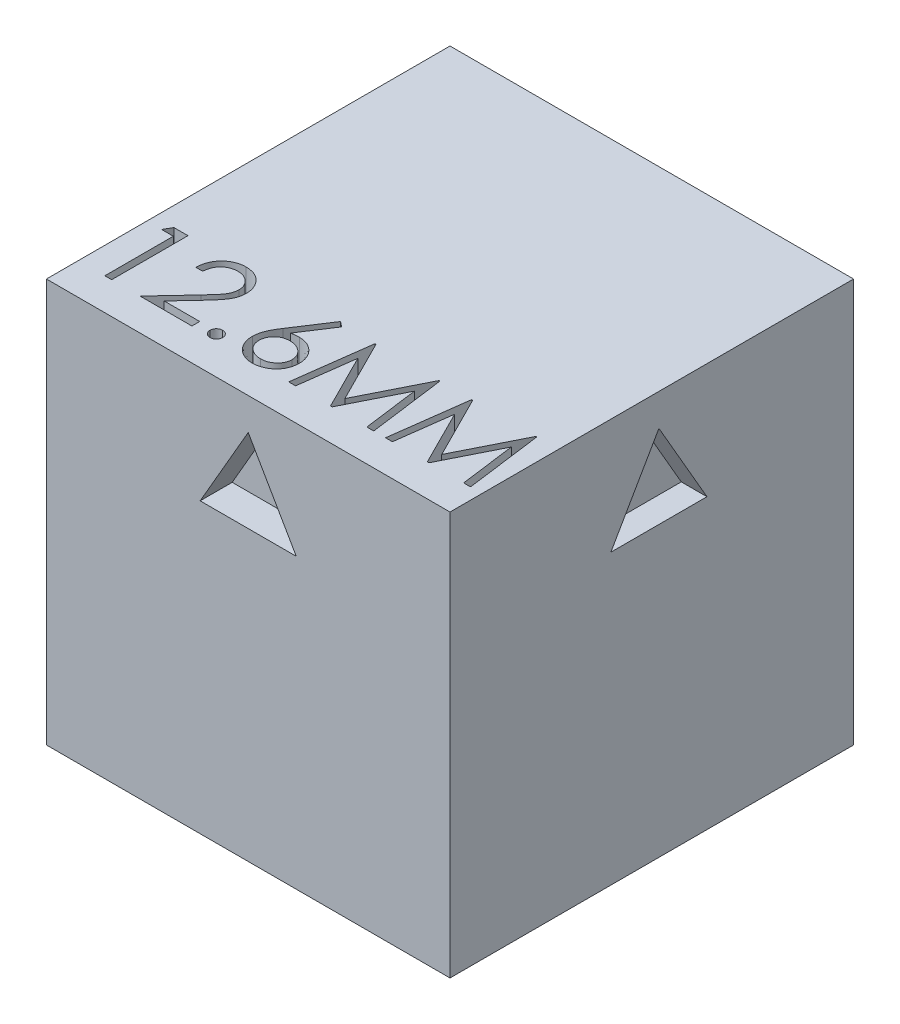
from build123d import *

# Parameters (mm, degrees)
CROQUIS1_W              = 12.6
CROQUIS1_H              = 12.6
SALIENTE_EXTRUIR1_DEPTH = 12.6
CORTAR_EXTRUIR1_DEPTH   = 1
CORTAR_EXTRUIR2_DEPTH   = 1
MATRIZC1_COUNT          = 4


with BuildPart() as part:
    # Croquis1 → Saliente-Extruir1 (new body)
    with BuildSketch(Plane.XY):
        Rectangle(CROQUIS1_W, CROQUIS1_H)
    extrude(amount=SALIENTE_EXTRUIR1_DEPTH)

    # Croquis2 → Cortar-Extruir1 (cut)
    # profile 1 of 6: a face of its own
    with BuildSketch(Plane(origin=(0, 6.3, 0), x_dir=(1, 0, 0), z_dir=(0, 1, 0))):
        Polygon((-5.702302434, -9.21875), (-5.262019231, -9.21875), (-5.262019231, -11.6), (-5.475721154, -11.6), (-5.475721154, -9.462980769), (-5.842067308, -9.462980769), align=None)
    # profile 2 of 6: a face of its own
    with BuildSketch(Plane(origin=(0, 6.3, 0), x_dir=(1, 0, 0), z_dir=(0, 1, 0))):
        with BuildLine():
            Line((-4.071394231, -9.951442308), (-4.285096154, -9.951442308))
            add(Edge.make_bspline(
                [(-4.285096154, -9.951442308), (-4.283703359, -9.923091222), (-4.280967946, -9.867410443), (-4.268157985, -9.786227571), (-4.249828567, -9.708629574), (-4.223912774, -9.635239507), (-4.19172761, -9.565408462), (-4.153130931, -9.499413808), (-4.107415114, -9.437507303), (-4.055567319, -9.38026284), (-3.999255084, -9.327747725), (-3.93849515, -9.282398354), (-3.874647015, -9.244082224), (-3.807904389, -9.212050165), (-3.737514255, -9.188006449), (-3.664115382, -9.170166369), (-3.587385291, -9.159432819), (-3.535106633, -9.158279079), (-3.50851863, -9.157692308)],
                knots=[0, 0, 0, 0, 1.10065271, 2.161652631, 3.183658789, 4.190468796, 5.17591951, 6.163126047, 7.15150782, 8.156236427, 9.156009102, 10.134482811, 11.092018607, 12.041330605, 13.001268258, 13.972401359, 14.968799086, 16, 16, 16, 16], degree=3))
            add(Edge.make_bspline(
                [(-3.50851863, -9.157692308), (-3.482407833, -9.158303579), (-3.43110105, -9.159504705), (-3.356219572, -9.16981962), (-3.284933592, -9.185975103), (-3.21738245, -9.208641484), (-3.15410511, -9.239110889), (-3.094626217, -9.275712429), (-3.038237666, -9.318044135), (-2.987478407, -9.367882891), (-2.940868446, -9.421088442), (-2.900657805, -9.477890033), (-2.866222778, -9.536556744), (-2.837520088, -9.597535931), (-2.816390822, -9.661401755), (-2.80034922, -9.727224406), (-2.791281819, -9.795685215), (-2.789890201, -9.842021996), (-2.789182692, -9.865579928)],
                knots=[0, 0, 0, 0, 1.111607364, 2.184268762, 3.212621178, 4.221274766, 5.211760367, 6.196651075, 7.1921475, 8.207485113, 9.220403448, 10.201281604, 11.166441695, 12.114753415, 13.065576456, 14.026450734, 14.996634279, 16, 16, 16, 16], degree=3))
            add(Edge.make_bspline(
                [(-2.789182692, -9.865579928), (-2.790334716, -9.898745865), (-2.792618546, -9.964495725), (-2.812154578, -10.061116551), (-2.842666222, -10.154729217), (-2.879403709, -10.230070131), (-2.916464426, -10.290780776), (-2.949861462, -10.340765734), (-2.988958057, -10.394585705), (-3.034323249, -10.452060465), (-3.085018614, -10.513640205), (-3.141503336, -10.579287727), (-3.204180205, -10.64832477), (-3.248171077, -10.695477331), (-3.270966046, -10.719910607)],
                knots=[0, 0, 0, 0, 1.184426356, 2.348067706, 3.509069118, 4.696110526, 5.333549288, 6.050745305, 6.844228056, 7.710549037, 8.667450064, 9.695053472, 10.805634456, 12, 12, 12, 12], degree=3))
            Line((-3.270966046, -10.719910607), (-3.866755559, -11.355769231))
            Line((-3.866755559, -11.355769231), (-2.758653846, -11.355769231))
            Line((-2.758653846, -11.355769231), (-2.758653846, -11.6))
            Line((-2.758653846, -11.6), (-4.376682692, -11.6))
            Line((-4.376682692, -11.6), (-3.453185096, -10.614490685))
            add(Edge.make_bspline(
                [(-3.453185096, -10.614490685), (-3.43070073, -10.591019516), (-3.387512865, -10.545936203), (-3.326428648, -10.480116439), (-3.271565336, -10.419054698), (-3.222567788, -10.36286635), (-3.180498921, -10.310729515), (-3.143166206, -10.264332762), (-3.113253903, -10.221637323), (-3.080790392, -10.172147727), (-3.04934838, -10.111723633), (-3.022329795, -10.037881962), (-3.00585505, -9.961867527), (-3.003878724, -9.910499177), (-3.002884615, -9.884660457)],
                knots=[0, 0, 0, 0, 1.329631726, 2.553950428, 3.673215718, 4.687767853, 5.603093632, 6.413772471, 7.123043292, 7.734684054, 8.834405432, 9.900288307, 10.943827018, 12, 12, 12, 12], degree=3))
            add(Edge.make_bspline(
                [(-3.002884615, -9.884660457), (-3.003317147, -9.868412577), (-3.004169584, -9.836391125), (-3.011692768, -9.789442564), (-3.02306188, -9.744154718), (-3.039353207, -9.700388282), (-3.060857079, -9.658583294), (-3.087032718, -9.618688865), (-3.117233814, -9.580120123), (-3.152171017, -9.543956897), (-3.190550998, -9.510836291), (-3.231096371, -9.481496512), (-3.27399296, -9.456977045), (-3.3190599, -9.436876916), (-3.36617155, -9.42110938), (-3.415419028, -9.410183811), (-3.466666261, -9.403324121), (-3.501659407, -9.402395996), (-3.519489934, -9.401923077)],
                knots=[0, 0, 0, 0, 0.991446411, 1.95395049, 2.89581595, 3.838931463, 4.798493298, 5.75982156, 6.748411868, 7.785213223, 8.824556874, 9.840280684, 10.836137867, 11.835679398, 12.848801643, 13.863922112, 14.911575587, 16, 16, 16, 16], degree=3))
            add(Edge.make_bspline(
                [(-3.519489934, -9.401923077), (-3.538111875, -9.402409554), (-3.574682294, -9.403364915), (-3.628375422, -9.410047835), (-3.679596638, -9.421577059), (-3.72847479, -9.437345474), (-3.77509258, -9.457387809), (-3.819223295, -9.482351299), (-3.860767868, -9.512139711), (-3.899804396, -9.545913019), (-3.935770781, -9.583514726), (-3.967371245, -9.625431504), (-3.994982869, -9.670898014), (-4.019073794, -9.719791574), (-4.038637933, -9.772555842), (-4.053587523, -9.829003513), (-4.065416788, -9.888889488), (-4.069368657, -9.930245055), (-4.071394231, -9.951442308)],
                knots=[0, 0, 0, 0, 1.031018746, 2.02475058, 2.990194455, 3.934040569, 4.864654155, 5.795059489, 6.735614925, 7.690564532, 8.649604399, 9.611025574, 10.590972636, 11.591080095, 12.624614302, 13.701020113, 14.821632451, 16, 16, 16, 16], degree=3))
        make_face()
    # profile 3 of 6: a face of its own
    with BuildSketch(Plane(origin=(0, 6.3, 0), x_dir=(1, 0, 0), z_dir=(0, 1, 0))):
        with BuildLine():
            add(Edge.make_bspline(
                [(-2.163341346, -11.233653846), (-2.150081041, -11.234441813), (-2.124085763, -11.23598653), (-2.086503428, -11.246584232), (-2.052489204, -11.265401999), (-2.022191373, -11.290481853), (-1.99721786, -11.320890867), (-1.97772947, -11.354633798), (-1.967224085, -11.392530774), (-1.96569062, -11.418676678), (-1.964903846, -11.432091346)],
                knots=[0, 0, 0, 0, 1.020151414, 1.999887582, 2.974338812, 3.990962822, 5.007586832, 5.987933904, 6.967670073, 8, 8, 8, 8], degree=3))
            add(Edge.make_bspline(
                [(-1.964903846, -11.432091346), (-1.965717282, -11.445183683), (-1.967321365, -11.471001579), (-1.977705389, -11.508612717), (-1.997366384, -11.542376736), (-2.02201912, -11.573198369), (-2.052496694, -11.598331354), (-2.086583843, -11.616989023), (-2.123997538, -11.628345531), (-2.150066322, -11.629792172), (-2.163341346, -11.630528846)],
                knots=[0, 0, 0, 0, 1.009421747, 1.99056486, 2.972319754, 3.999869655, 5.017953583, 5.993804169, 6.978383603, 8, 8, 8, 8], degree=3))
            add(Edge.make_bspline(
                [(-2.163341346, -11.630528846), (-2.176625936, -11.629818827), (-2.202560934, -11.628432685), (-2.239834976, -11.616755847), (-2.274129718, -11.598506314), (-2.304601357, -11.573151506), (-2.329460567, -11.542535337), (-2.348255694, -11.508380186), (-2.35954292, -11.471109244), (-2.361027373, -11.445204889), (-2.361778846, -11.432091346)],
                knots=[0, 0, 0, 0, 1.022052826, 1.995314843, 2.982371812, 4.00089066, 5.028879526, 6.005146991, 6.990147033, 8, 8, 8, 8], degree=3))
            add(Edge.make_bspline(
                [(-2.361778846, -11.432091346), (-2.361056239, -11.418654715), (-2.359645438, -11.392421341), (-2.348231998, -11.354866234), (-2.329606397, -11.320733778), (-2.304429512, -11.290528247), (-2.274137089, -11.2652276), (-2.239917707, -11.246813875), (-2.202471162, -11.235900666), (-2.176610829, -11.234415775), (-2.163341346, -11.233653846)],
                knots=[0, 0, 0, 0, 1.032775665, 2.016367738, 2.991239715, 4.008302682, 5.025365648, 6.011011707, 6.979408107, 8, 8, 8, 8], degree=3))
        make_face()
    # profile 4 of 6: a face of its own
    with BuildSketch(Plane(origin=(0, 6.3, 0), x_dir=(1, 0, 0), z_dir=(0, 1, 0))):
        with BuildLine():
            Line((-0.560576923, -9.157692308), (-0.396007362, -9.286962891))
            Line((-0.396007362, -9.286962891), (-1.0251878, -10.249098558))
            add(Edge.make_bspline(
                [(-1.0251878, -10.249098558), (-0.983298023, -10.242421627), (-0.901587275, -10.22939752), (-0.818879048, -10.227248989), (-0.778571965, -10.226201923)],
                knots=[0, 0, 0, 0, 1.025318673, 2, 2, 2, 2], degree=3))
            add(Edge.make_bspline(
                [(-0.778571965, -10.226201923), (-0.754369963, -10.22685242), (-0.706729043, -10.228132905), (-0.6367837, -10.237987097), (-0.569571942, -10.253516325), (-0.505372345, -10.276153342), (-0.443954477, -10.305070122), (-0.384965883, -10.339726746), (-0.329515408, -10.381912754), (-0.276888981, -10.429037661), (-0.229109473, -10.481232609), (-0.18680755, -10.53661459), (-0.151274679, -10.595125904), (-0.122445279, -10.656736915), (-0.10005821, -10.72135265), (-0.083738044, -10.788890438), (-0.074090857, -10.85939685), (-0.072780835, -10.90734718), (-0.072115385, -10.931704477)],
                knots=[0, 0, 0, 0, 1.04369286, 2.054478336, 3.041073146, 4.015093852, 4.984733326, 5.965804835, 6.960378782, 7.985147595, 9.009457201, 10.008161701, 10.986880575, 11.956520048, 12.937015923, 13.931873656, 14.949455224, 16, 16, 16, 16], degree=3))
            add(Edge.make_bspline(
                [(-0.072115385, -10.931704477), (-0.073083604, -10.965028169), (-0.074988831, -11.030601307), (-0.093973378, -11.126107602), (-0.123473422, -11.217093474), (-0.165640276, -11.302106257), (-0.21801579, -11.381029434), (-0.281886081, -11.450960259), (-0.354986026, -11.513328624), (-0.437640437, -11.565482502), (-0.526592346, -11.608074935), (-0.620040759, -11.638667359), (-0.717078157, -11.657502005), (-0.782939863, -11.659863254), (-0.81625601, -11.661057692)],
                knots=[0, 0, 0, 0, 1.031375318, 2.029502543, 3.004789286, 3.987476834, 4.960371455, 5.9300674, 6.912260825, 7.929083631, 8.949397511, 9.960523116, 10.96833055, 12, 12, 12, 12], degree=3))
            add(Edge.make_bspline(
                [(-0.81625601, -11.661057692), (-0.848298586, -11.660017967), (-0.911769321, -11.657958452), (-1.005136632, -11.639611984), (-1.094850578, -11.609875544), (-1.180282603, -11.56890833), (-1.259422163, -11.517161806), (-1.330223962, -11.454866755), (-1.392334973, -11.38335478), (-1.444024849, -11.302636972), (-1.485022308, -11.215898269), (-1.515767596, -11.125453525), (-1.533726469, -11.031632287), (-1.536236005, -10.968031726), (-1.5375, -10.935997596)],
                knots=[0, 0, 0, 0, 1.012016664, 2.004627821, 2.994792927, 3.992885782, 4.990978636, 5.973936114, 6.964471063, 7.975201453, 8.993600317, 9.990122807, 10.98767138, 12, 12, 12, 12], degree=3))
            add(Edge.make_bspline(
                [(-1.5375, -10.935997596), (-1.536696195, -10.911474407), (-1.53505498, -10.861402739), (-1.523595459, -10.785567391), (-1.505181733, -10.707971923), (-1.48455994, -10.642144516), (-1.462771088, -10.588218374), (-1.444637842, -10.544741177), (-1.422067677, -10.500000162), (-1.398001144, -10.452461134), (-1.370271917, -10.40334926), (-1.340121449, -10.351843727), (-1.306716151, -10.298763673), (-1.283298147, -10.262742711), (-1.271326623, -10.244328425)],
                knots=[0, 0, 0, 0, 1.173818275, 2.396712641, 3.66331629, 4.989737886, 5.693666774, 6.447286557, 7.243889047, 8.091586357, 8.998013824, 9.943181721, 10.948533338, 12, 12, 12, 12], degree=3))
            Line((-1.271326623, -10.244328425), (-0.560576923, -9.157692308))
        make_face()
        with BuildLine():
            add(Edge.make_bspline(
                [(-0.823411208, -10.470432692), (-0.841551057, -10.47096204), (-0.876983451, -10.471996009), (-0.928967781, -10.478000333), (-0.978166618, -10.489307233), (-1.025231775, -10.503707898), (-1.069283337, -10.523508372), (-1.110641459, -10.547560221), (-1.149466074, -10.575877487), (-1.185350527, -10.608059), (-1.217884976, -10.643293358), (-1.245902853, -10.681032444), (-1.270070771, -10.72036675), (-1.289720723, -10.761624928), (-1.305022007, -10.804791207), (-1.316090227, -10.849667054), (-1.322250012, -10.896553394), (-1.323274787, -10.928348186), (-1.323798077, -10.944583834)],
                knots=[0, 0, 0, 0, 1.129588631, 2.206414736, 3.251139165, 4.268635594, 5.265702196, 6.250456724, 7.242448911, 8.251968645, 9.246821453, 10.222880186, 11.173611482, 12.116736599, 13.062300278, 14.020270554, 14.989073742, 16, 16, 16, 16], degree=3))
            add(Edge.make_bspline(
                [(-1.323798077, -10.944583834), (-1.323371927, -10.960674267), (-1.322536312, -10.99222521), (-1.314948751, -11.038720259), (-1.303358811, -11.083463884), (-1.286118292, -11.126225418), (-1.265553213, -11.167656663), (-1.23840334, -11.20625692), (-1.208320134, -11.244370575), (-1.172360583, -11.27906979), (-1.133768438, -11.311357244), (-1.092537977, -11.33957863), (-1.049566647, -11.363721902), (-1.004274305, -11.382643381), (-0.957303547, -11.398172047), (-0.908263027, -11.409099589), (-0.857118638, -11.41527759), (-0.822473534, -11.4163037), (-0.804807692, -11.416826923)],
                knots=[0, 0, 0, 0, 0.989467248, 1.94019797, 2.891935182, 3.827694429, 4.772920941, 5.730924762, 6.725747692, 7.756678648, 8.79901574, 9.819492441, 10.826891316, 11.826466727, 12.835195252, 13.867842842, 14.912794438, 16, 16, 16, 16], degree=3))
            add(Edge.make_bspline(
                [(-0.804807692, -11.416826923), (-0.78714188, -11.416303659), (-0.752496832, -11.415277469), (-0.701352032, -11.409100051), (-0.652313033, -11.398170353), (-0.605336748, -11.382649522), (-0.56006481, -11.36369912), (-0.517131062, -11.339728831), (-0.476290519, -11.311183687), (-0.43767304, -11.279124967), (-0.401863164, -11.24417308), (-0.371058444, -11.206597144), (-0.34474003, -11.16734469), (-0.323353556, -11.126388626), (-0.306302928, -11.083438028), (-0.294654215, -11.038727186), (-0.287082324, -10.992223397), (-0.286244555, -10.960673654), (-0.285817308, -10.944583834)],
                knots=[0, 0, 0, 0, 1.087397944, 2.132534446, 3.165364764, 4.174271784, 5.174024072, 6.181601208, 7.194203697, 8.236725232, 9.267838612, 10.269026844, 11.221737037, 12.171628256, 13.107553087, 14.05945871, 15.010357665, 16, 16, 16, 16], degree=3))
            add(Edge.make_bspline(
                [(-0.285817308, -10.944583834), (-0.286191703, -10.928327006), (-0.286926521, -10.896420139), (-0.295237728, -10.849688027), (-0.306764594, -10.804563199), (-0.324170191, -10.761329259), (-0.346782912, -10.720156815), (-0.374326087, -10.680837887), (-0.406188961, -10.643071026), (-0.442994608, -10.607989901), (-0.483060999, -10.575913049), (-0.52566196, -10.547596887), (-0.570230778, -10.523699358), (-0.616722264, -10.503760062), (-0.665669118, -10.489370866), (-0.716281117, -10.478040713), (-0.769205584, -10.472011376), (-0.805112526, -10.470965623), (-0.823411208, -10.470432692)],
                knots=[0, 0, 0, 0, 0.978206639, 1.919901502, 2.851605144, 3.780102724, 4.718870031, 5.675451981, 6.667674623, 7.690630536, 8.733308323, 9.756129687, 10.767539656, 11.776269907, 12.797430371, 13.836405707, 14.897401972, 16, 16, 16, 16], degree=3))
        make_face(mode=Mode.SUBTRACT)
    # profile 5 of 6: a face of its own
    with BuildSketch(Plane(origin=(0, 6.3, 0), x_dir=(1, 0, 0), z_dir=(0, 1, 0))):
        Polygon((0.263701923, -11.6), (0.578053636, -9.21875), (0.608582482, -9.21875), (1.591706731, -11.172596154), (2.572445913, -9.21875), (2.603451773, -9.21875), (2.919711538, -11.6), (2.705055589, -11.6), (2.477043269, -9.88656851), (1.617465445, -11.6), (1.569287109, -11.6), (0.706370192, -9.882752404), (0.478834886, -11.6), align=None)
    # profile 6 of 6: a face of its own
    with BuildSketch(Plane(origin=(0, 6.3, 0), x_dir=(1, 0, 0), z_dir=(0, 1, 0))):
        Polygon((3.286057692, -11.6), (3.600409405, -9.21875), (3.630938251, -9.21875), (4.6140625, -11.172596154), (5.594801683, -9.21875), (5.625807542, -9.21875), (5.942067308, -11.6), (5.727411358, -11.6), (5.499399038, -9.88656851), (4.639821214, -11.6), (4.591642879, -11.6), (3.728725962, -9.882752404), (3.501190655, -11.6), align=None)
    extrude(amount=-CORTAR_EXTRUIR1_DEPTH, mode=Mode.SUBTRACT)

    # Croquis4 → Cortar-Extruir2 (cut)
    with BuildSketch(Plane.XY.offset(12.6)):
        Polygon((0, 5.3), (-1.5, 2.701923789), (1.5, 2.701923789), align=None)
    cortar_extruir2 = extrude(amount=-CORTAR_EXTRUIR2_DEPTH, mode=Mode.SUBTRACT)

    # MatrizC1: Cortar-Extruir2 ×4 about axis
    matrizc1_axis = Axis((-0.012179611, 0, 6.089725651), (0, 1, 0))
    for i in range(1, MATRIZC1_COUNT):
        add(cortar_extruir2.rotate(matrizc1_axis, i * 360 / MATRIZC1_COUNT), mode=Mode.SUBTRACT)


solid = part.part
